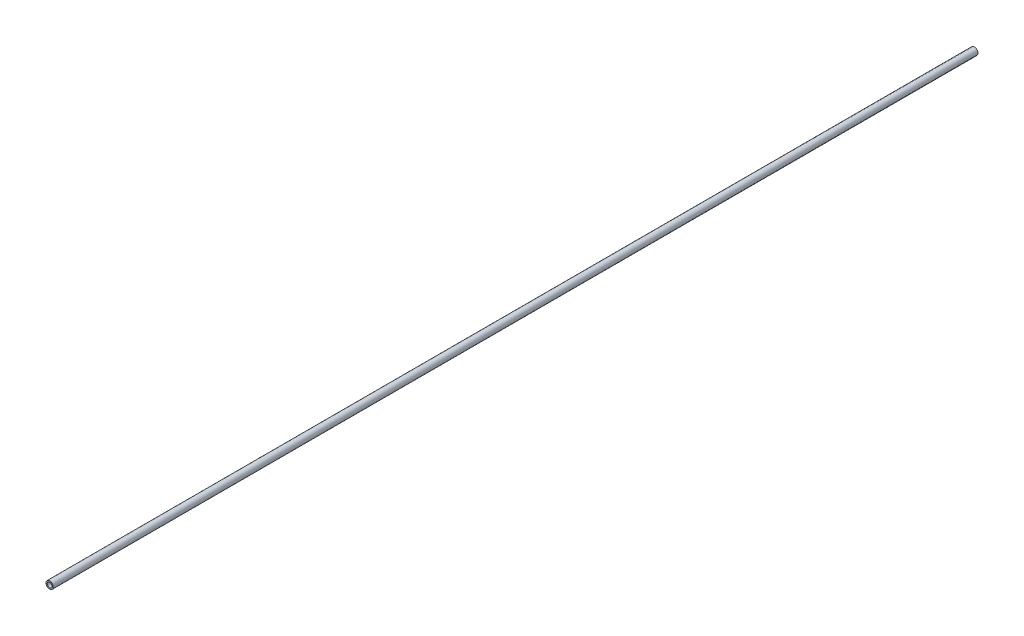
from build123d import *

# Parameters (mm, degrees)
SKETCH1_R           = 4.7625
SKETCH1_R_2         = 3.175
BOSS_EXTRUDE1_DEPTH = 1219.2


with BuildPart() as part:
    # Sketch1 → Boss-Extrude1 (new body)
    with BuildSketch(Plane.XY):
        with Locations(Location((0, 0, 0), (0, 0, 180))):
            Circle(SKETCH1_R)
        with Locations(Location((0, 0, 0), (0, 0, 180))):
            Circle(SKETCH1_R_2, mode=Mode.SUBTRACT)
    extrude(amount=BOSS_EXTRUDE1_DEPTH)


solid = part.part
